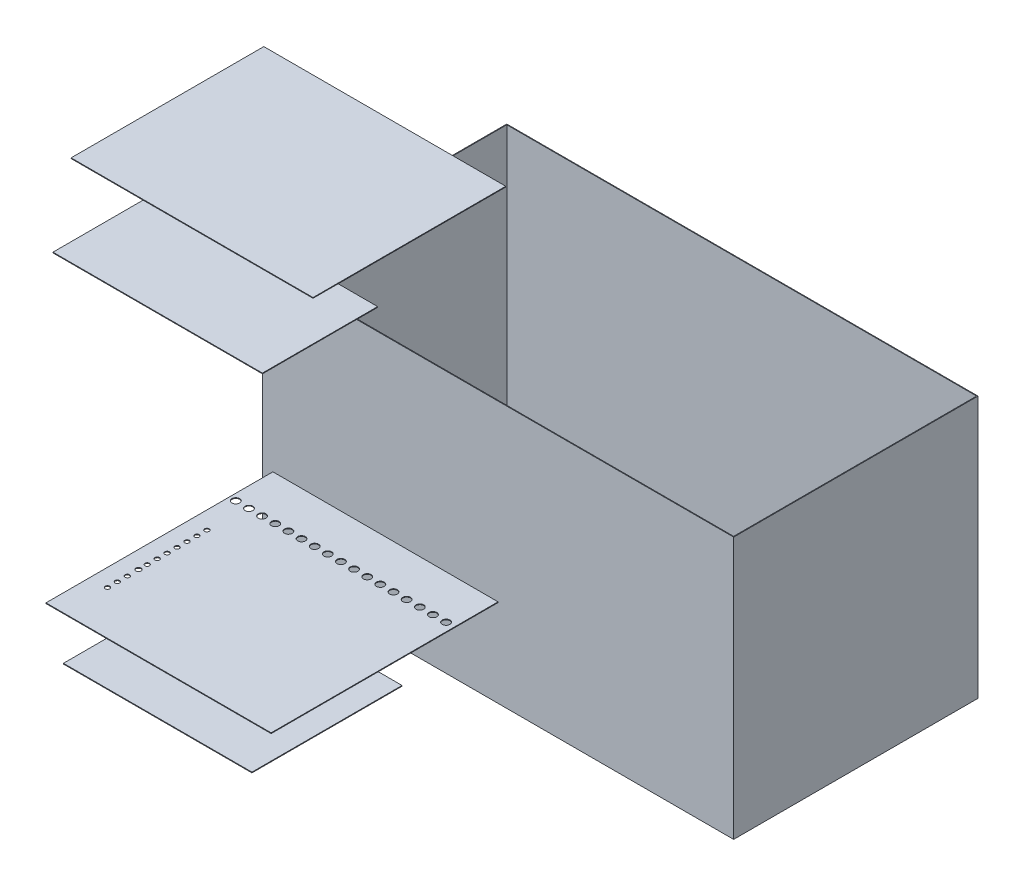
from build123d import *

# Parameters (mm, degrees)
MASTER_FOOTPRINT_W            = 1350
MASTER_FOOTPRINT_H            = 700
BATH_BASE_PLATE_DEPTH         = 750
BATH_SHELL_2MM_T              = -2
INLET_IMPACT_BAFFLE_START     = 125
SKETCH_1_W                    = 540
SKETCH_1_H                    = 430
INLET_IMPACT_BAFFLE_DEPTH     = 2
DISTRIBUTOR_D22_START         = 250
SKETCH_2_W                    = 645
SKETCH_2_H                    = 652
SKETCH_2_R                    = 11
SKETCH_2_R_2                  = 6.470588235
SKETCH_2_R_3                  = 7.356528537
DISTRIBUTOR_D22_DEPTH         = 2
OUTLET_SUBMERGED_BAFFLE_START = 1130
SKETCH_3_W                    = 600
SKETCH_3_H                    = 330
OUTLET_SUBMERGED_BAFFLE_DEPTH = 2
OVERFLOW_WEIR_Z550_START      = 1290
SKETCH_4_W                    = 693
SKETCH_4_H                    = 552
OVERFLOW_WEIR_Z550_DEPTH      = 2


with BuildPart() as part:
    # MASTER_FOOTPRINT → BATH_BASE_PLATE (new body)
    with BuildSketch(Plane(origin=(0, 0, 0), x_dir=(1, 0, 0), z_dir=(0, 1, 0))):
        with Locations((675, 350)):
            Rectangle(MASTER_FOOTPRINT_W, MASTER_FOOTPRINT_H)
    extrude(amount=BATH_BASE_PLATE_DEPTH)

    # BATH_SHELL_2MM
    bath_shell_2mm_openings = [part.faces().sort_by_distance(p)[0] for p in [
        (675, 750, -350),
    ]]
    offset(amount=BATH_SHELL_2MM_T, openings=bath_shell_2mm_openings, kind=Kind.INTERSECTION)


with BuildPart() as body_2:
    # Эскиз1 → INLET_IMPACT_BAFFLE (new body)
    with BuildSketch(Plane(origin=(0, 0, 0), x_dir=(1, 0, 0), z_dir=(0, 1, 0)).offset(INLET_IMPACT_BAFFLE_START)):
        with Locations((350, -435)):
            Rectangle(SKETCH_1_W, SKETCH_1_H)
    extrude(amount=INLET_IMPACT_BAFFLE_DEPTH)


with BuildPart() as body_3:
    # Эскиз2 → DISTRIBUTOR_D22 (new body)
    with BuildSketch(Plane(origin=(0, 0, 0), x_dir=(1, 0, 0), z_dir=(0, 1, 0)).offset(DISTRIBUTOR_D22_START)):
        with Locations((352.5, -324)):
            Rectangle(SKETCH_2_W, SKETCH_2_H)
        with Locations(Location((48.823529412, -125, 0), (0, 0, 270))):
            Circle(SKETCH_2_R, mode=Mode.SUBTRACT)
        with Locations(Location((86.470588235, -125, 0), (0, 0, 270))):
            Circle(SKETCH_2_R, mode=Mode.SUBTRACT)
        with Locations(Location((80, -239, 0), (0, 0, 270))):
            Circle(SKETCH_2_R_2, mode=Mode.SUBTRACT)
        with Locations(Location((80, -267.5, 0), (0, 0, 270))):
            Circle(SKETCH_2_R_2, mode=Mode.SUBTRACT)
        with Locations(Location((80, -296, 0), (0, 0, 270))):
            Circle(SKETCH_2_R_2, mode=Mode.SUBTRACT)
        with Locations(Location((80, -324.5, 0), (0, 0, 270))):
            Circle(SKETCH_2_R_2, mode=Mode.SUBTRACT)
        with Locations(Location((80, -353, 0), (0, 0, 270))):
            Circle(SKETCH_2_R_2, mode=Mode.SUBTRACT)
        with Locations(Location((80, -381.5, 0), (0, 0, 270))):
            Circle(SKETCH_2_R_2, mode=Mode.SUBTRACT)
        with Locations(Location((80, -410, 0), (0, 0, 270))):
            Circle(SKETCH_2_R_2, mode=Mode.SUBTRACT)
        with Locations(Location((80, -435, 0), (0, 0, 270))):
            Circle(SKETCH_2_R_3, mode=Mode.SUBTRACT)
        with Locations(Location((80, -467, 0), (0, 0, 270))):
            Circle(SKETCH_2_R_2, mode=Mode.SUBTRACT)
        with Locations(Location((80, -495.5, 0), (0, 0, 270))):
            Circle(SKETCH_2_R_2, mode=Mode.SUBTRACT)
        with Locations(Location((80, -524, 0), (0, 0, 270))):
            Circle(SKETCH_2_R_2, mode=Mode.SUBTRACT)
        with Locations(Location((124.117647059, -125, 0), (0, 0, 270))):
            Circle(SKETCH_2_R, mode=Mode.SUBTRACT)
        with Locations(Location((161.764705882, -125, 0), (0, 0, 270))):
            Circle(SKETCH_2_R, mode=Mode.SUBTRACT)
        with Locations(Location((199.411764706, -125, 0), (0, 0, 270))):
            Circle(SKETCH_2_R, mode=Mode.SUBTRACT)
        with Locations(Location((237.058823529, -125, 0), (0, 0, 270))):
            Circle(SKETCH_2_R, mode=Mode.SUBTRACT)
        with Locations(Location((274.705882353, -125, 0), (0, 0, 270))):
            Circle(SKETCH_2_R, mode=Mode.SUBTRACT)
        with Locations(Location((312.352941176, -125, 0), (0, 0, 270))):
            Circle(SKETCH_2_R, mode=Mode.SUBTRACT)
        with Locations(Location((350, -125, 0), (0, 0, 270))):
            Circle(SKETCH_2_R, mode=Mode.SUBTRACT)
        with Locations(Location((387.647058824, -125, 0), (0, 0, 270))):
            Circle(SKETCH_2_R, mode=Mode.SUBTRACT)
        with Locations(Location((425.294117647, -125, 0), (0, 0, 270))):
            Circle(SKETCH_2_R, mode=Mode.SUBTRACT)
        with Locations(Location((462.941176471, -125, 0), (0, 0, 270))):
            Circle(SKETCH_2_R, mode=Mode.SUBTRACT)
        with Locations(Location((500.588235294, -125, 0), (0, 0, 270))):
            Circle(SKETCH_2_R, mode=Mode.SUBTRACT)
        with Locations(Location((538.235294118, -125, 0), (0, 0, 270))):
            Circle(SKETCH_2_R, mode=Mode.SUBTRACT)
        with Locations(Location((575.882352941, -125, 0), (0, 0, 270))):
            Circle(SKETCH_2_R, mode=Mode.SUBTRACT)
        with Locations(Location((613.529411765, -125, 0), (0, 0, 270))):
            Circle(SKETCH_2_R, mode=Mode.SUBTRACT)
        with Locations(Location((651.176470588, -125, 0), (0, 0, 270))):
            Circle(SKETCH_2_R, mode=Mode.SUBTRACT)
    extrude(amount=DISTRIBUTOR_D22_DEPTH)


with BuildPart() as body_4:
    # Эскиз3 → OUTLET_SUBMERGED_BAFFLE (new body)
    with BuildSketch(Plane(origin=(0, 0, 0), x_dir=(1, 0, 0), z_dir=(0, 1, 0)).offset(OUTLET_SUBMERGED_BAFFLE_START)):
        with Locations((350, -485)):
            Rectangle(SKETCH_3_W, SKETCH_3_H)
    extrude(amount=OUTLET_SUBMERGED_BAFFLE_DEPTH)


with BuildPart() as body_5:
    # Эскиз4 → OVERFLOW_WEIR_Z550 (new body)
    with BuildSketch(Plane(origin=(0, 0, 0), x_dir=(1, 0, 0), z_dir=(0, 1, 0)).offset(OVERFLOW_WEIR_Z550_START)):
        with Locations((348.5, -274)):
            Rectangle(SKETCH_4_W, SKETCH_4_H)
    extrude(amount=OVERFLOW_WEIR_Z550_DEPTH)


solid = Compound([part.part, body_2.part, body_3.part, body_4.part, body_5.part])
